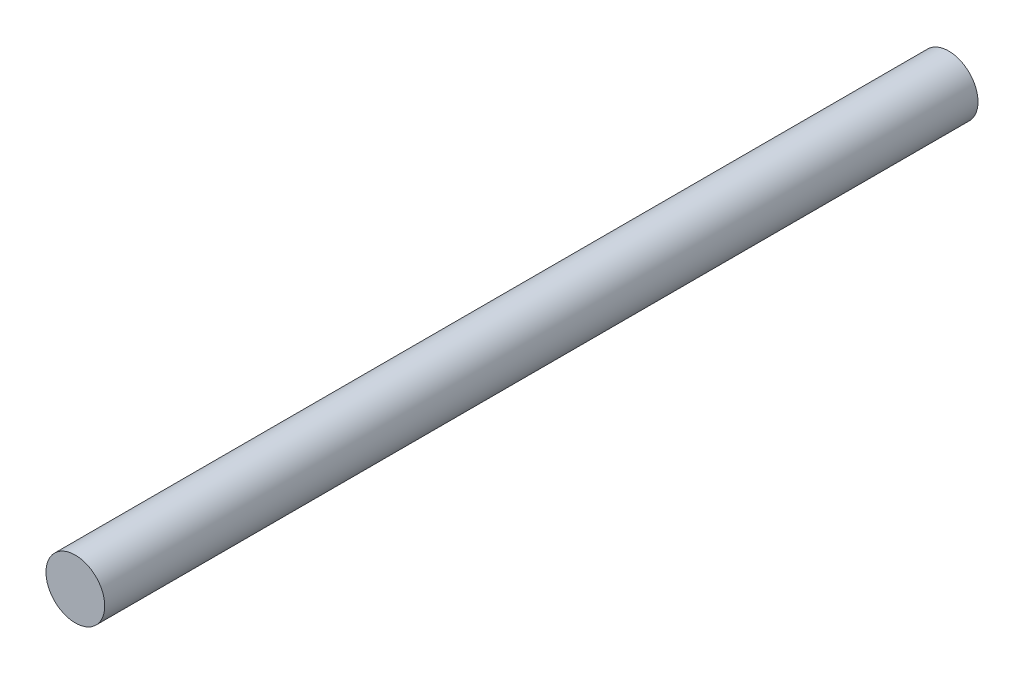
from build123d import *

# Parameters (mm, degrees)
SKETCH1_R           = 5
BOSS_EXTRUDE1_DEPTH = 74.25


with BuildPart() as part:
    # Sketch1 → Boss-Extrude1 (new, symmetric)
    with BuildSketch(Plane.XY):
        Circle(SKETCH1_R)
    extrude(amount=BOSS_EXTRUDE1_DEPTH, both=True)


solid = part.part
